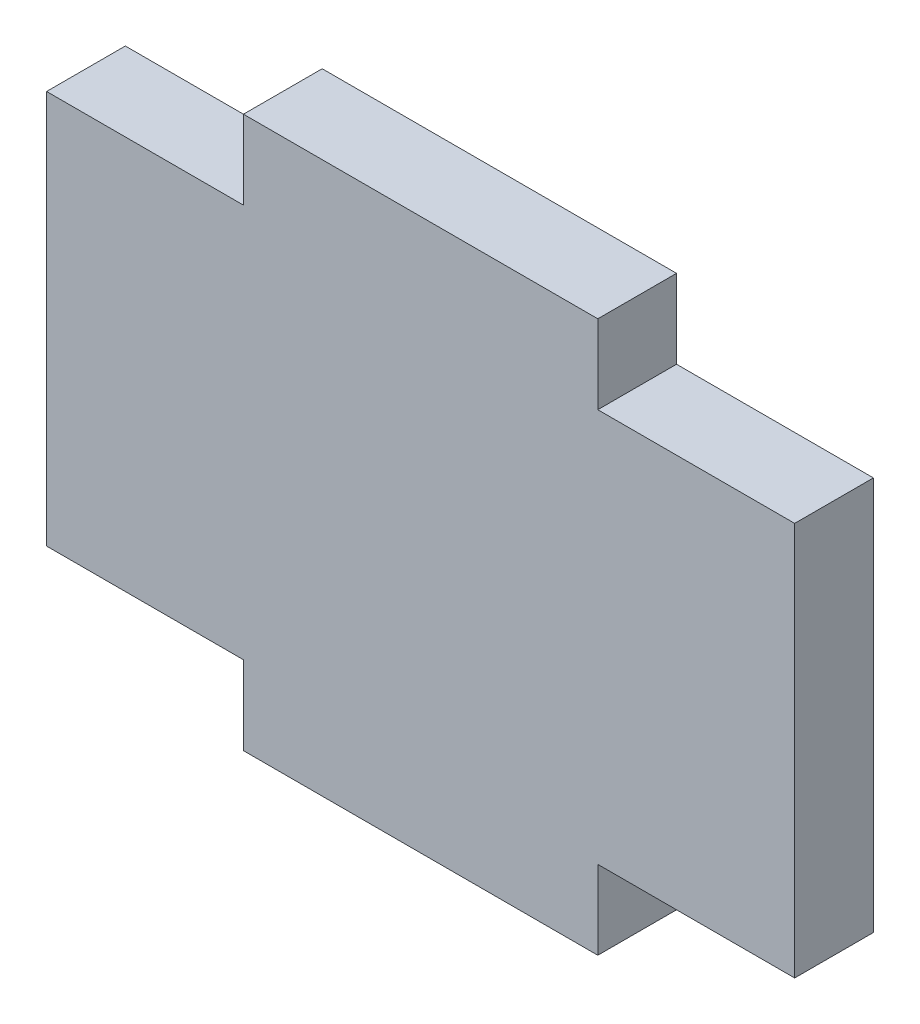
from build123d import *

# Parameters (mm, degrees)
BOSS_EXTRUDE1_DEPTH = 4


with BuildPart() as part:
    # Sketch1 → Boss-Extrude1 (new body)
    with BuildSketch(Plane.XY):
        Polygon((9, 0), (19, 0), (19, 20), (9, 20), (9, 24), (-9, 24), (-9, 20), (-19, 20), (-19, 0), (-9, 0), (-9, -4), (9, -4), align=None)
    extrude(amount=BOSS_EXTRUDE1_DEPTH)


solid = part.part
